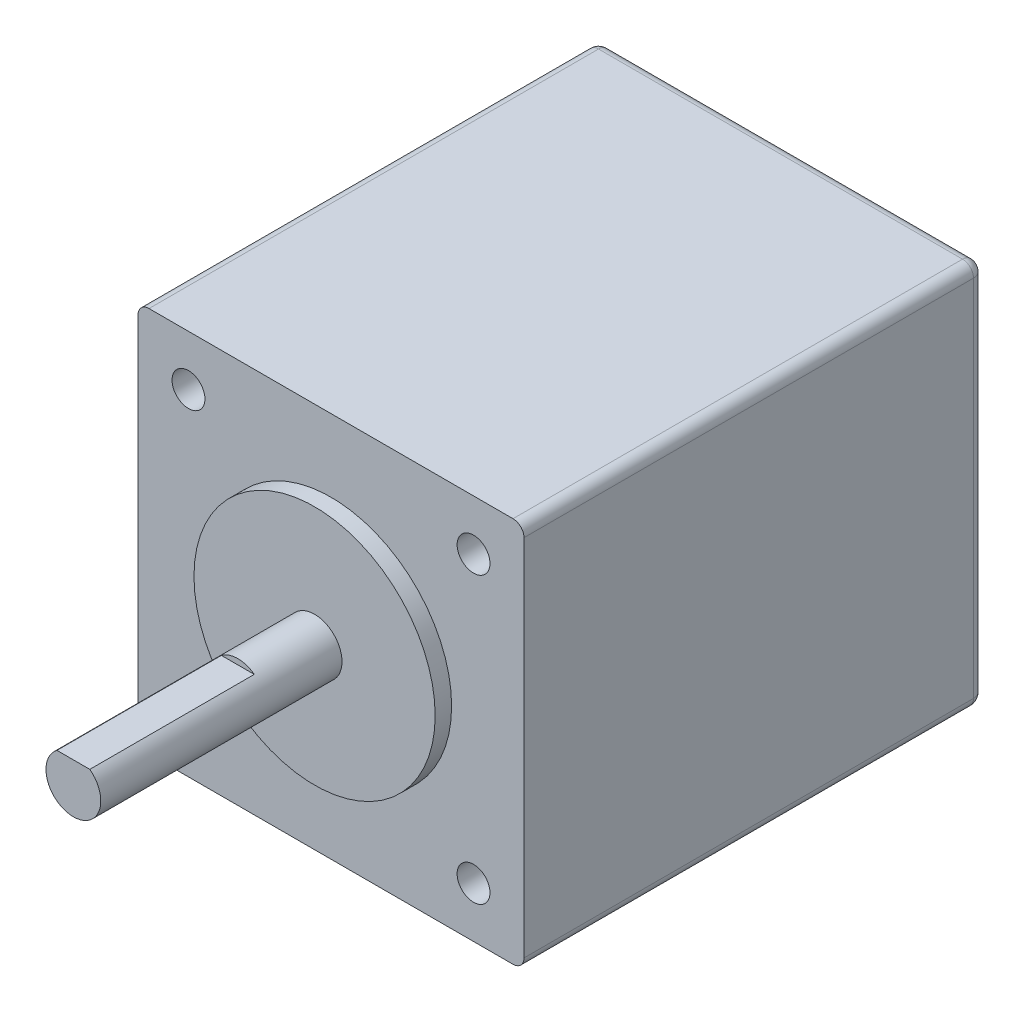
from build123d import *

# Parameters (mm, degrees)
SKETCH1_W           = 35.2
SKETCH1_H           = 35.2
BOSS_EXTRUDE1_DEPTH = 42
SKETCH2_R           = 11
BOSS_EXTRUDE2_DEPTH = 1.5
SKETCH3_R           = 2.5
BOSS_EXTRUDE3_DEPTH = 22
SKETCH4_W           = 15
SKETCH4_H           = 0.5
CUT_EXTRUDE1_DEPTH  = 5
SKETCH5_R           = 1.5
CUT_EXTRUDE2_DEPTH  = 4.5
FILLET1_R           = 1


with BuildPart() as part:
    # Sketch1 → Boss-Extrude1 (new body)
    with BuildSketch(Plane.XY):
        Rectangle(SKETCH1_W, SKETCH1_H)
    extrude(amount=BOSS_EXTRUDE1_DEPTH)

    # Sketch2 → Boss-Extrude2 (add)
    with BuildSketch(Plane.XY.offset(42)):
        with Locations(Location((0, 0, 0), (0, 0, 180))):
            Circle(SKETCH2_R)
    extrude(amount=BOSS_EXTRUDE2_DEPTH)

    # Sketch3 → Boss-Extrude3 (add)
    with BuildSketch(Plane.XY.offset(43.5)):
        Circle(SKETCH3_R)
    extrude(amount=BOSS_EXTRUDE3_DEPTH)

    # Sketch4 → Cut-Extrude1 (cut, symmetric)
    with BuildSketch(Plane(origin=(0, 0, 0), x_dir=(0, 0, -1), z_dir=(1, 0, 0))):
        with Locations((-58, 2.25)):
            Rectangle(SKETCH4_W, SKETCH4_H)
    extrude(amount=CUT_EXTRUDE1_DEPTH, both=True, mode=Mode.SUBTRACT)

    # Sketch5 → Cut-Extrude2 (cut)
    with BuildSketch(Plane.XY.offset(42)):
        with Locations((-13, 13)):
            Circle(SKETCH5_R)
        with Locations((13, 13)):
            Circle(SKETCH5_R)
        with Locations((13, -13)):
            Circle(SKETCH5_R)
        with Locations((-13, -13)):
            Circle(SKETCH5_R)
    extrude(amount=-CUT_EXTRUDE2_DEPTH, mode=Mode.SUBTRACT)

    # Fillet1
    fillet1_edges = [part.edges().sort_by_distance(p)[0] for p in [
        (0, -17.6, 0),
        (-17.6, 0, 0),
        (0, 17.6, 0),
        (17.6, 0, 0),
        (17.6, -17.6, 21),
        (-17.6, -17.6, 21),
        (-17.6, 17.6, 21),
        (17.6, 17.6, 21),
    ]]
    fillet(fillet1_edges, radius=FILLET1_R)


solid = part.part
